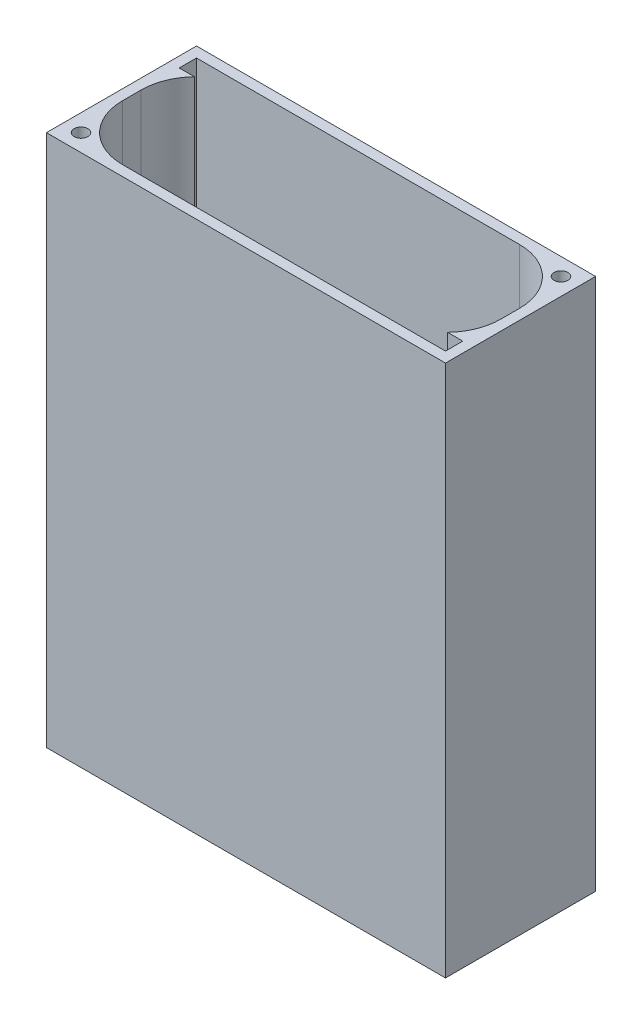
from build123d import *

# Parameters (mm, degrees)
SKETCH1_W           = 57.7
SKETCH1_H           = 21.7
BOSS_EXTRUDE1_DEPTH = 2
SKETCH2_W           = 57.7
SKETCH2_H           = 21.7
SKETCH2_W_2         = 54.7
SKETCH2_H_2         = 18.7
BOSS_EXTRUDE2_DEPTH = 75
FILLET1_R           = 8
SKETCH3_W           = 38.583587397
SKETCH3_H           = 2.5
CUT_EXTRUDE1_DEPTH  = 75
SKETCH4_W           = 17.089400488
SKETCH4_H           = 2.5
CUT_EXTRUDE2_DEPTH  = 75
SKETCH5_R           = 1
CUT_EXTRUDE3_DEPTH  = 8
SKETCH6_R           = 1.5
CUT_EXTRUDE4_DEPTH  = 10


with BuildPart() as part:
    # Sketch1 → Boss-Extrude1 (new body)
    with BuildSketch(Plane(origin=(0, 0, 0), x_dir=(1, 0, 0), z_dir=(0, 1, 0))):
        with Locations((28.85, 10.85)):
            Rectangle(SKETCH1_W, SKETCH1_H)
    extrude(amount=BOSS_EXTRUDE1_DEPTH)

    # Sketch2 → Boss-Extrude2 (add)
    with BuildSketch(Plane(origin=(0, 2, 0), x_dir=(1, 0, 0), z_dir=(0, 1, 0))):
        with Locations((28.85, 10.85)):
            Rectangle(SKETCH2_W, SKETCH2_H)
        with Locations((28.85, 10.85)):
            Rectangle(SKETCH2_W_2, SKETCH2_H_2, mode=Mode.SUBTRACT)
    extrude(amount=BOSS_EXTRUDE2_DEPTH)

    # Fillet1
    fillet1_edges = [part.edges().sort_by_distance(p)[0] for p in [
        (1.5, 39.5, -20.2),
        (1.5, 39.5, -1.5),
        (56.2, 39.5, -1.5),
        (56.2, 39.5, -20.2),
    ]]
    fillet(fillet1_edges, radius=FILLET1_R)

    # Sketch3 → Cut-Extrude1 (cut)
    with BuildSketch(Plane(origin=(0, 77, 0), x_dir=(1, 0, 0), z_dir=(0, 1, 0))):
        with Locations((20.791793699, 18.95)):
            Rectangle(SKETCH3_W, SKETCH3_H)
    extrude(amount=-CUT_EXTRUDE1_DEPTH, mode=Mode.SUBTRACT)

    # Sketch4 → Cut-Extrude2 (cut)
    with BuildSketch(Plane(origin=(0, 77, 0), x_dir=(1, 0, 0), z_dir=(0, 1, 0))):
        with Locations((47.655299756, 2.75)):
            Rectangle(SKETCH4_W, SKETCH4_H)
    extrude(amount=-CUT_EXTRUDE2_DEPTH, mode=Mode.SUBTRACT)

    # Sketch5 → Cut-Extrude3 (cut)
    with BuildSketch(Plane(origin=(0, 77, 0), x_dir=(1, 0, 0), z_dir=(0, 1, 0))):
        with Locations(Location((55.2, 19.2, 0), (0, 0, 270))):
            Circle(SKETCH5_R)
        with Locations(Location((2.5, 2.5, 0), (0, 0, 270))):
            Circle(SKETCH5_R)
    extrude(amount=-CUT_EXTRUDE3_DEPTH, mode=Mode.SUBTRACT)

    # Sketch6 → Cut-Extrude4 (cut)
    with BuildSketch(Plane(origin=(0, 2, 0), x_dir=(1, 0, 0), z_dir=(0, 1, 0))):
        with Locations(Location((28.85, 10.85, 0), (0, 0, 270))):
            Circle(SKETCH6_R)
        with Locations(Location((10.85, 10.85, 0), (0, 0, 270))):
            Circle(SKETCH6_R)
        with Locations(Location((46.85, 10.85, 0), (0, 0, 270))):
            Circle(SKETCH6_R)
    extrude(amount=-CUT_EXTRUDE4_DEPTH, mode=Mode.SUBTRACT)


solid = part.part
